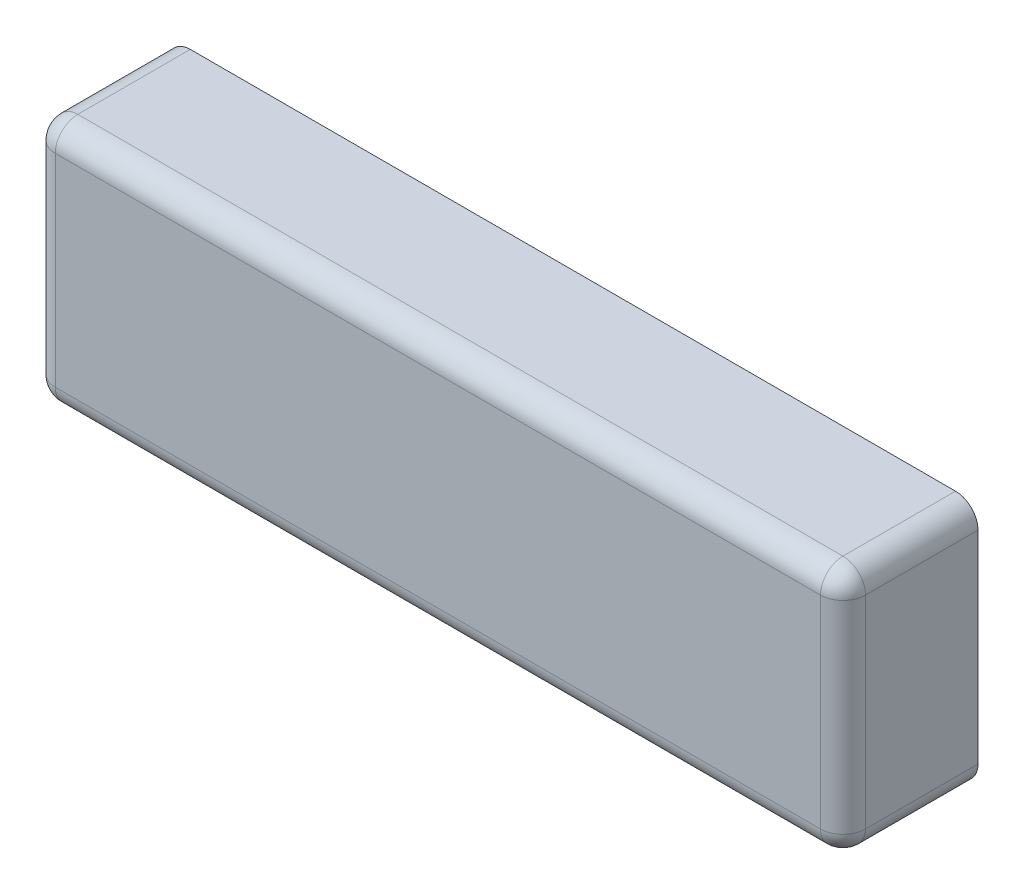
from build123d import *

# Parameters (mm, degrees)
SKETCH1_W           = 180
SKETCH1_H           = 55
BOSS_EXTRUDE1_DEPTH = 30
FILLET1_R           = 5


with BuildPart() as part:
    # Sketch1 → Boss-Extrude1 (new body)
    with BuildSketch(Plane.XY):
        with Locations((14.363839286, 20.513392857)):
            Rectangle(SKETCH1_W, SKETCH1_H)
    extrude(amount=BOSS_EXTRUDE1_DEPTH)

    # Fillet1
    fillet1_edges = [part.edges().sort_by_distance(p)[0] for p in [
        (104.363839286, 20.513392857, 30),
        (14.363839286, 48.013392857, 30),
        (-75.636160714, 20.513392857, 30),
        (14.363839286, -6.986607143, 30),
        (-75.636160714, 48.013392857, 15),
        (104.363839286, 48.013392857, 15),
        (104.363839286, -6.986607143, 15),
        (-75.636160714, -6.986607143, 15),
    ]]
    fillet(fillet1_edges, radius=FILLET1_R)


solid = part.part
